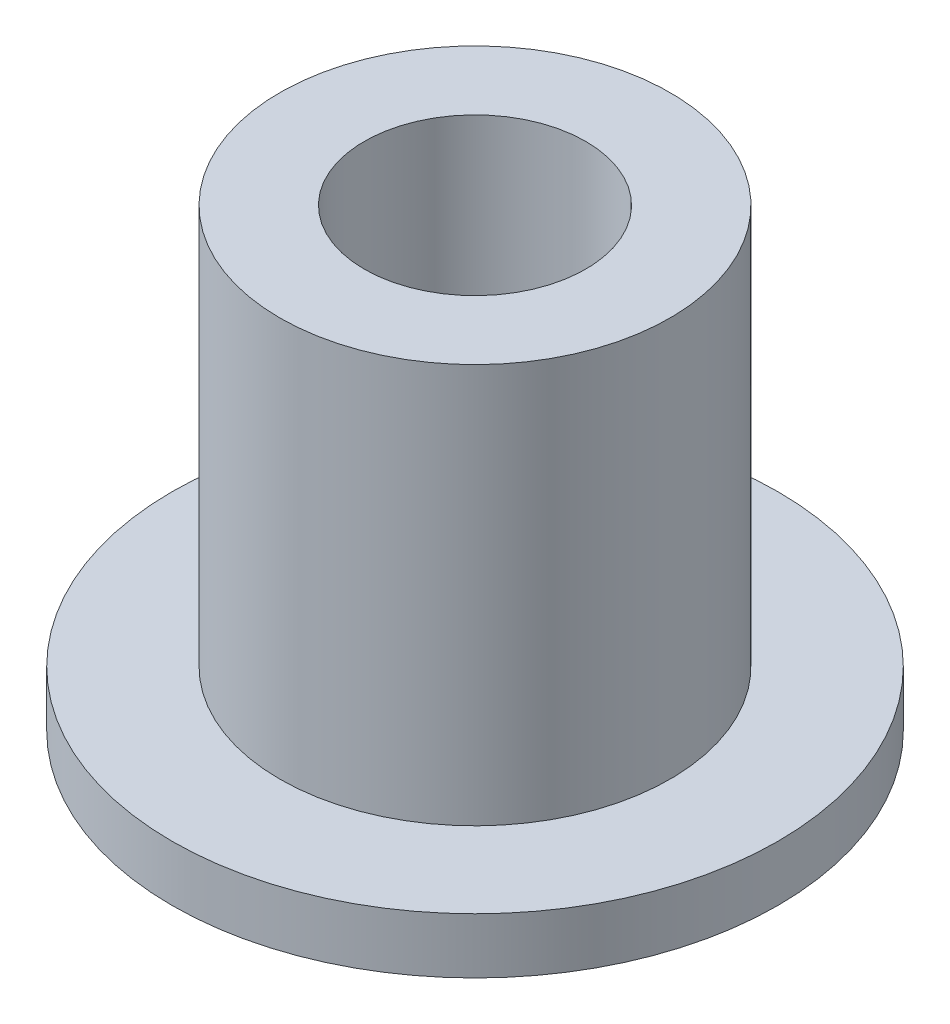
from build123d import *


with BuildPart() as part:
    # Sketch1 → Revolve4 (revolve)
    with BuildSketch(Plane.XY, mode=Mode.PRIVATE) as revolve4_sk:
        Polygon((2.19, 9), (2.19, 0), (5.99, 0), (5.99, 1.1), (3.86, 1.1), (3.86, 9), align=None)
    revolve(revolve4_sk.sketch.rotate(Axis((0, 0, 0), (0, -1, 0)), 90), axis=Axis((0, 0, 0), (0, -1, 0)))


solid = part.part
